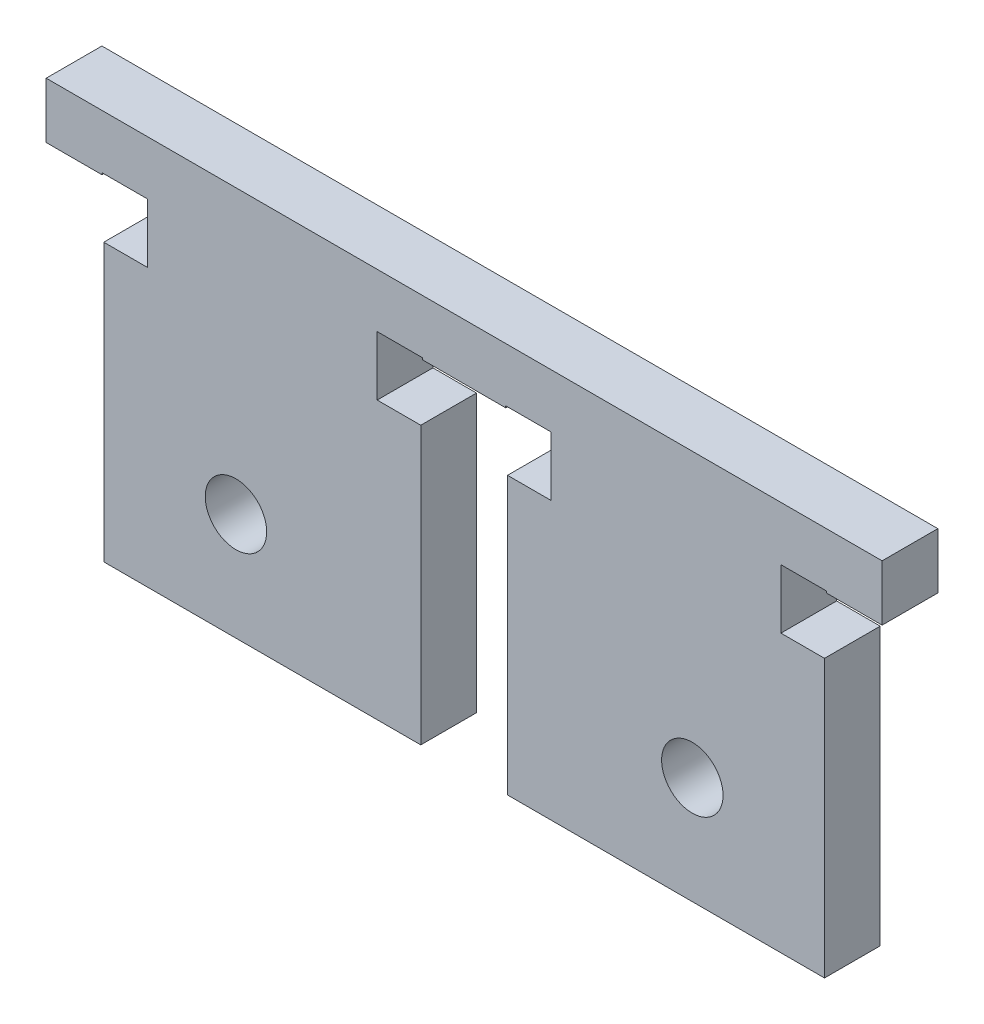
from build123d import *

# Parameters (mm, degrees)
SKETCH3_W            = 95.25
SKETCH3_H            = 60.96
BOSS_EXTRUDE1_DEPTH  = 6.35
SKETCH4_W            = 6.56336
SKETCH4_H            = 45.72
SKETCH4_W_2          = 9.8836988
CUT_EXTRUDE1_DEPTH   = 6.35
SKETCH5_W            = 5.1689
SKETCH5_H            = 6.7564
CUT_EXTRUDE2_DEPTH   = 57.898976485
SKETCH9_W            = 95.25
SKETCH9_H            = 6.35
CUT_EXTRUDE6_DEPTH   = 8.89
SKETCH11_W           = 82.12328
SKETCH11_H           = 6.35
CUT_EXTRUDE9_DEPTH   = 7.62
M6_CLEARANCE_HOLE2_D = 7


with BuildPart() as part:
    # Sketch3 → Boss-Extrude1 (new body)
    with BuildSketch(Plane.XY):
        Rectangle(SKETCH3_W, SKETCH3_H)
    extrude(amount=BOSS_EXTRUDE1_DEPTH)

    # Sketch4 → Cut-Extrude1 (cut)
    with BuildSketch(Plane.XY.offset(6.35)):
        with Locations((-44.34332, -7.62)):
            Rectangle(SKETCH4_W, SKETCH4_H)
        with Locations((0, -7.62)):
            Rectangle(SKETCH4_W_2, SKETCH4_H)
        with Locations((44.34332, -7.62)):
            Rectangle(SKETCH4_W, SKETCH4_H)
    extrude(amount=-CUT_EXTRUDE1_DEPTH, mode=Mode.SUBTRACT)

    # Sketch5 → Cut-Extrude2 (cut, through all)
    with BuildSketch(Plane.XY.offset(6.35)):
        with Locations((-38.68039, 12.065)):
            Rectangle(SKETCH5_W, SKETCH5_H)
        with Locations((-7.3230994, 12.065)):
            Rectangle(SKETCH5_W, SKETCH5_H)
    cut_extrude2 = extrude(amount=-CUT_EXTRUDE2_DEPTH, mode=Mode.SUBTRACT)

    # Mirror1: Cut-Extrude2 across plane
    add(cut_extrude2.mirror(Plane(origin=(0, 0, 0), x_dir=(0, 0, 1), z_dir=(1, 0, 0))), mode=Mode.SUBTRACT)

    # Sketch9 → Cut-Extrude6 (cut)
    with BuildSketch(Plane(origin=(0, 30.48, 0), x_dir=(1, 0, 0), z_dir=(0, 1, 0))):
        with Locations((0, -3.175)):
            Rectangle(SKETCH9_W, SKETCH9_H)
    extrude(amount=-CUT_EXTRUDE6_DEPTH, mode=Mode.SUBTRACT)

    # Sketch11 → Cut-Extrude9 (cut)
    with BuildSketch(Plane.XZ.offset(30.48)):
        with Locations((0, 3.175)):
            Rectangle(SKETCH11_W, SKETCH11_H)
    extrude(amount=-CUT_EXTRUDE9_DEPTH, mode=Mode.SUBTRACT)

    # M6 Clearance Hole2 (through all)
    with Locations(Plane.XY.offset(6.35)):
        with Locations((26, -10.6279), (-26, -10.6279)):
            Hole(M6_CLEARANCE_HOLE2_D / 2)


solid = part.part
